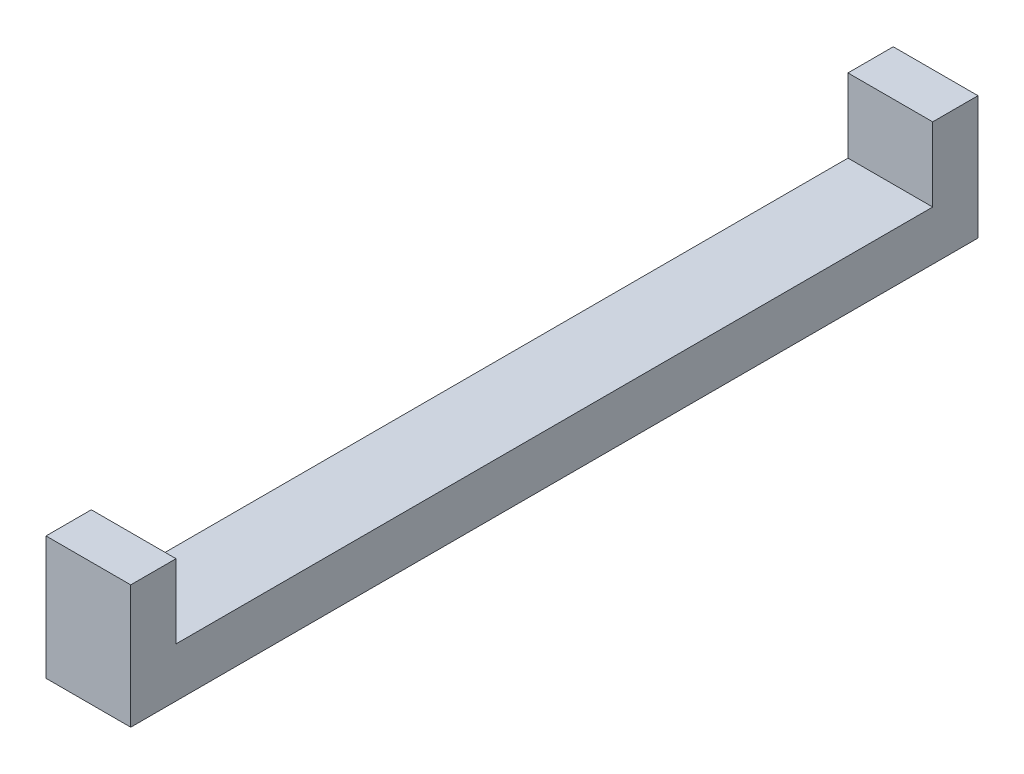
from build123d import *

# Parameters (mm, degrees)
EXTRUDE_1_DEPTH = 5


with BuildPart() as part:
    # 스케치1 → 보스-돌출1 (new, symmetric)
    with BuildSketch(Plane(origin=(0, 0, 0), x_dir=(0, 0, -1), z_dir=(1, 0, 0))):
        Polygon((50, 0), (-50, 0), (-50, 14.555892452), (-44.652146268, 14.555892452), (-44.652146268, 5.846857921), (44.652146268, 5.846857921), (44.652146268, 14.555892452), (50, 14.555892452), align=None)
    extrude(amount=EXTRUDE_1_DEPTH, both=True)


solid = part.part
